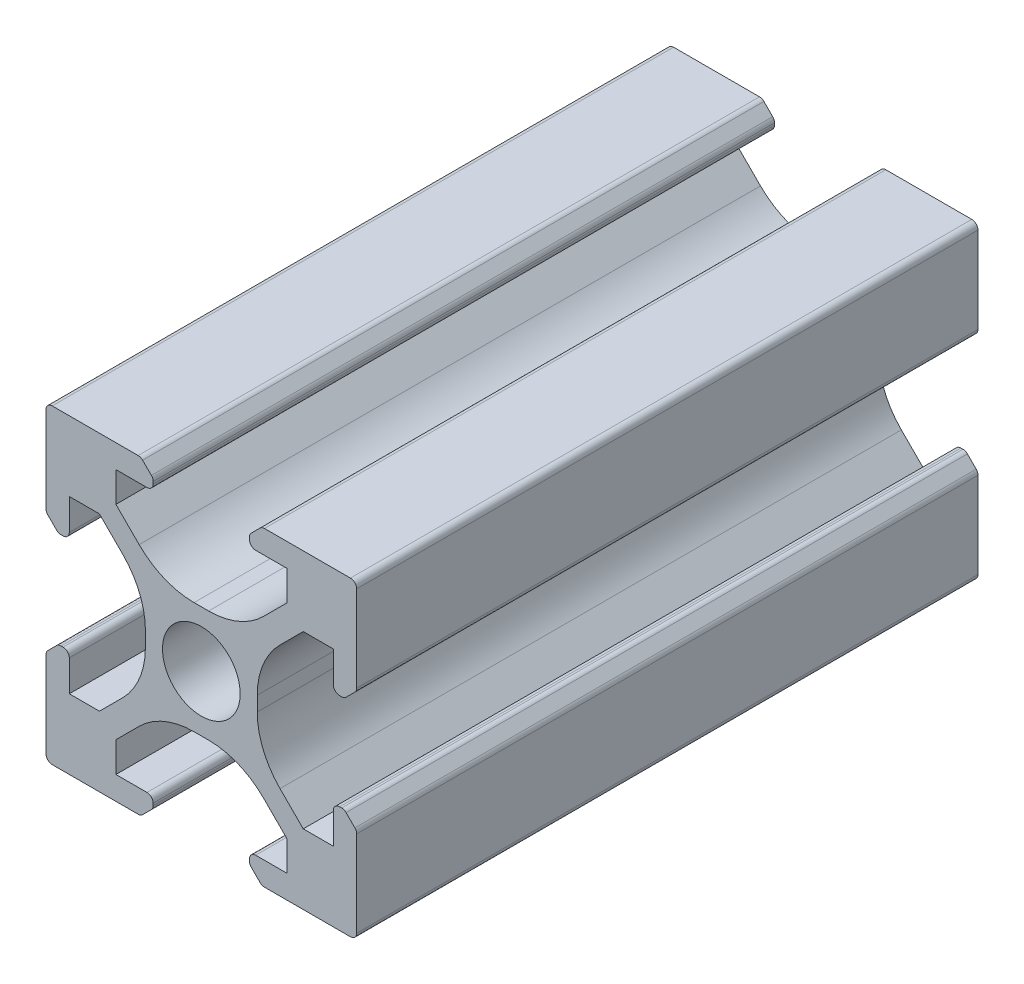
from build123d import *

# Parameters (mm, degrees)
RESSALTO_EXTRUS_O1_DEPTH = 40
PADR_OCIRCULAR1_COUNT    = 4
FILETE1_R                = 0.4


with BuildPart() as part:
    # Esboço1 → Ressalto-extrusão1 (new body)
    with BuildSketch(Plane.XY):
        with BuildLine():
            ThreePointArc((-9.317157288, 3.217157288), (-9.187387948, 3.130448187), (-9.034314575, 3.1))
            Line((-9.034314575, 3.1), (-8.9, 3.1))
            ThreePointArc((-8.9, 3.1), (-8.617157288, 3.217157288), (-8.5, 3.5))
            Line((-8.5, 3.5), (-8.5, 5.5))
            Line((-8.5, 5.5), (-6.560660172, 5.5))
            Line((-6.560660172, 5.5), (-5.064466094, 4.003805922))
            ThreePointArc((-5.064466094, 4.003805922), (-3.980602337, 2.381689178), (-3.6, 0.468272016))
            Line((-3.6, 0.468272016), (-3.6, 0))
            Line((-3.6, 0), (-2.5, 0))
            ThreePointArc((-2.5, 0), (-1.767766953, 1.767766953), (0, 2.5))
            Line((0, 2.5), (0, 3.6))
            Line((0, 3.6), (-0.468272016, 3.6))
            ThreePointArc((-0.468272016, 3.6), (-2.381689178, 3.980602337), (-4.003805922, 5.064466094))
            Line((-4.003805922, 5.064466094), (-5.5, 6.560660172))
            Line((-5.5, 6.560660172), (-5.5, 8.5))
            Line((-5.5, 8.5), (-3.5, 8.5))
            ThreePointArc((-3.5, 8.5), (-3.217157288, 8.617157288), (-3.1, 8.9))
            Line((-3.1, 8.9), (-3.1, 9.034314575))
            ThreePointArc((-3.1, 9.034314575), (-3.130448187, 9.187387948), (-3.217157288, 9.317157288))
            Line((-3.217157288, 9.317157288), (-3.782842712, 9.882842712))
            ThreePointArc((-3.782842712, 9.882842712), (-3.912612052, 9.969551813), (-4.065685425, 10))
            Line((-4.065685425, 10), (-10, 10))
            Line((-10, 10), (-10, 4.065685425))
            ThreePointArc((-10, 4.065685425), (-9.969551813, 3.912612052), (-9.882842712, 3.782842712))
            Line((-9.882842712, 3.782842712), (-9.317157288, 3.217157288))
        make_face()
    ressalto_extrus_o1 = extrude(amount=RESSALTO_EXTRUS_O1_DEPTH)

    # PadrãoCircular1: Ressalto-extrusão1 ×4 about axis
    padr_ocircular1_axis = Axis((0, 0, 0), (0, 0, 1))
    for i in range(1, PADR_OCIRCULAR1_COUNT):
        add(ressalto_extrus_o1.rotate(padr_ocircular1_axis, i * 360 / PADR_OCIRCULAR1_COUNT))

    # Filete1
    filete1_edges = [part.edges().sort_by_distance(p)[0] for p in [
        (10, -10, 20),
        (10, 10, 20),
        (-10, 10, 20),
        (-10, -10, 20),
    ]]
    fillet(filete1_edges, radius=FILETE1_R)


solid = part.part
